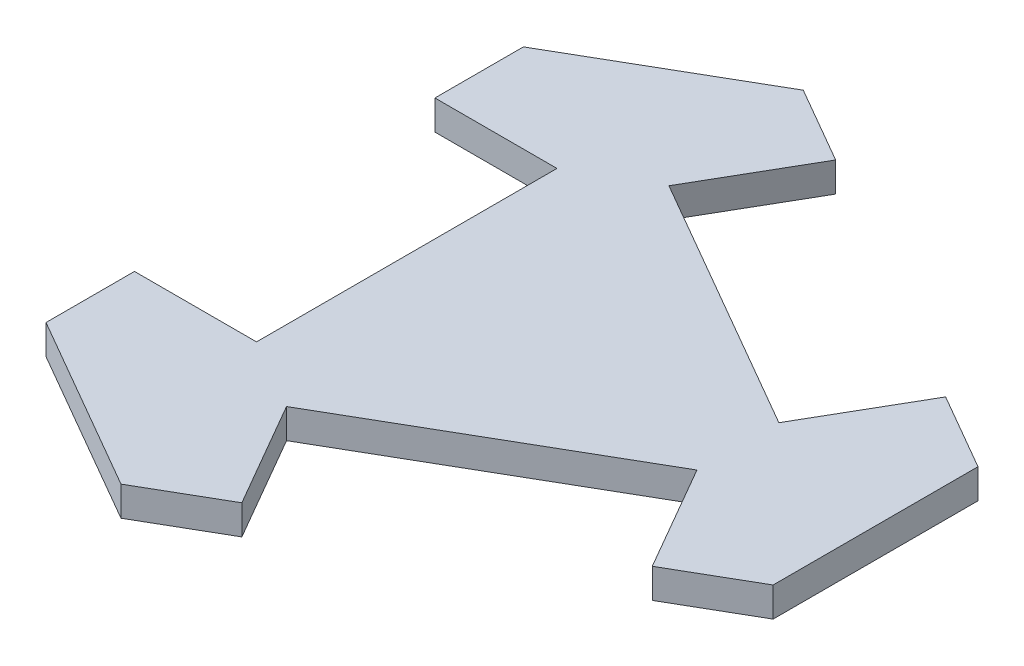
from build123d import *

# Parameters (mm, degrees)
BOSS_EXTRUDE1_DEPTH = 10


with BuildPart() as part:
    # Sketch2 → Boss-Extrude1 (new body)
    with BuildSketch(Plane(origin=(0, 0, 0), x_dir=(1, 0, 0), z_dir=(0, 1, 0))):
        Polygon((-26.602540378, 115.358983849), (-86.602540378, 80.717967697), (-86.602540378, 50.8), (-45.327540378, 50.8), (-45.327540378, -50.8), (-86.602540378, -50.8), (-86.602540378, -80.717967697), (-26.602540378, -115.358983849), (-0.692820323, -100.4), (-21.330320323, -64.654801459), (66.657860701, -13.854801459), (87.295360701, -49.6), (113.205080757, -34.641016151), (113.205080757, 34.641016151), (87.295360701, 49.6), (66.657860701, 13.854801459), (-21.330320323, 64.654801459), (-0.692820323, 100.4), align=None)
    extrude(amount=BOSS_EXTRUDE1_DEPTH)


solid = part.part
